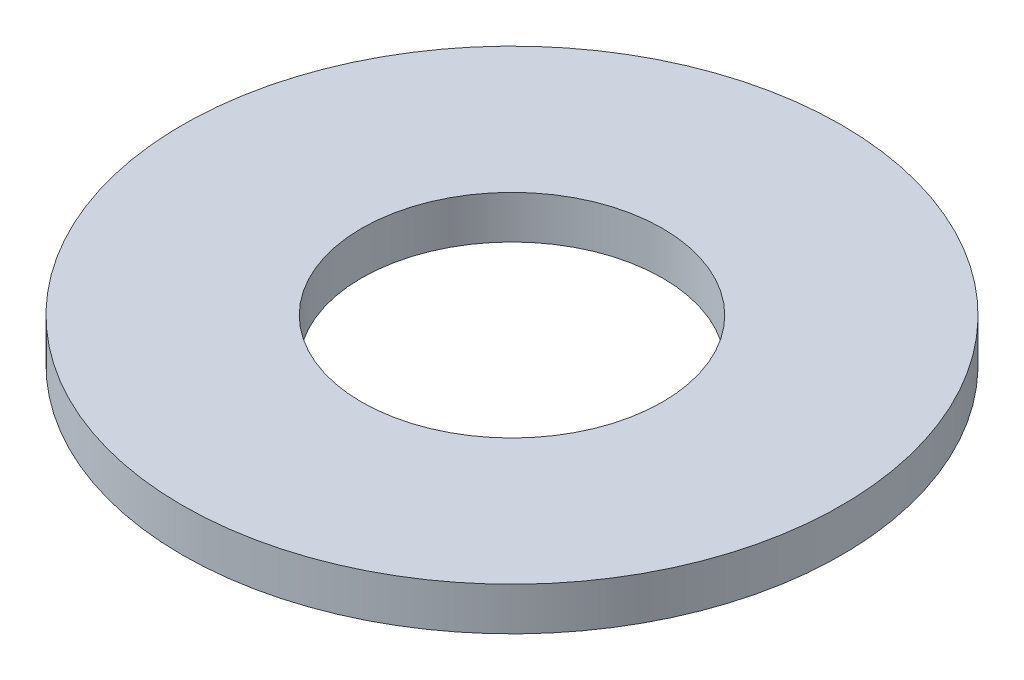
from build123d import *

# Parameters (mm, degrees)
SKETCH1_R           = 29.21
SKETCH1_R_2         = 13.335
BOSS_EXTRUDE1_DEPTH = 3.81


with BuildPart() as part:
    # Sketch1 → Boss-Extrude1 (new body)
    with BuildSketch(Plane(origin=(0, 0, 0), x_dir=(1, 0, 0), z_dir=(0, 1, 0))):
        with Locations(Location((0, 0, 0), (0, 0, 90))):
            Circle(SKETCH1_R)
        with Locations(Location((0, 0, 0), (0, 0, 90))):
            Circle(SKETCH1_R_2, mode=Mode.SUBTRACT)
    extrude(amount=BOSS_EXTRUDE1_DEPTH)


solid = part.part
